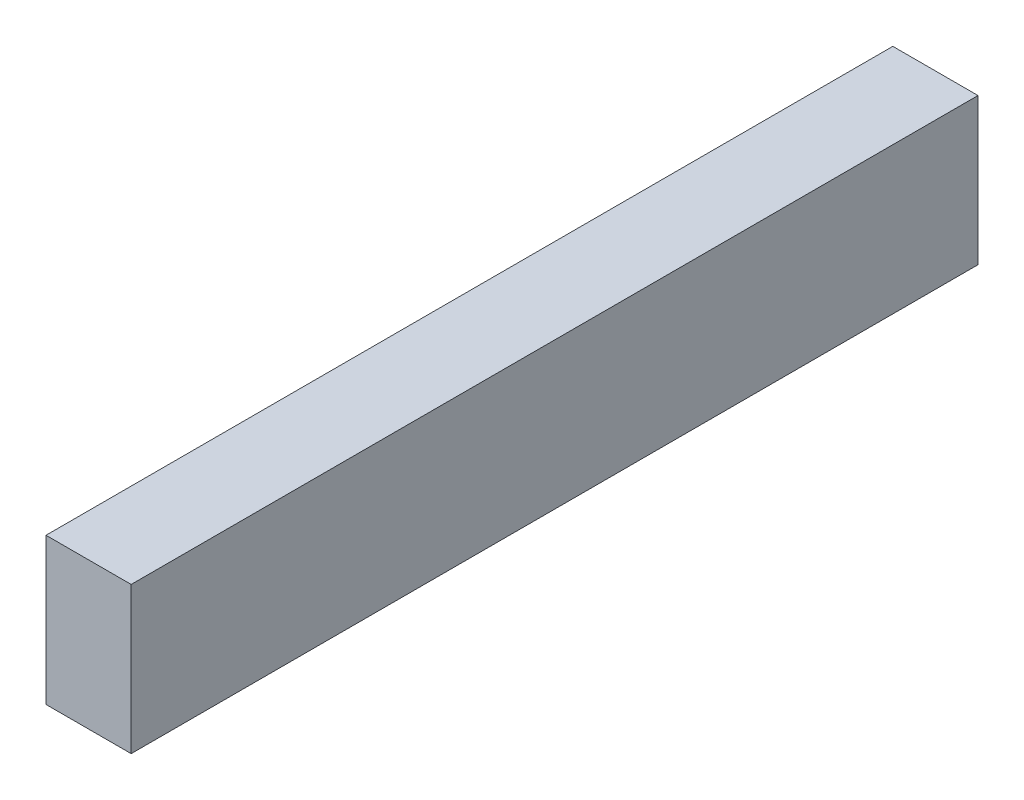
from build123d import *

# Parameters (mm, degrees)
SKETCH1_W           = 1.32842
SKETCH1_H           = 13.208
BOSS_EXTRUDE1_DEPTH = 2.286


with BuildPart() as part:
    # Sketch1 → Boss-Extrude1 (new body)
    with BuildSketch(Plane(origin=(0, 0, 0), x_dir=(1, 0, 0), z_dir=(0, 1, 0))):
        with Locations((-0.66421, -6.604)):
            Rectangle(SKETCH1_W, SKETCH1_H)
    extrude(amount=BOSS_EXTRUDE1_DEPTH)


solid = part.part
